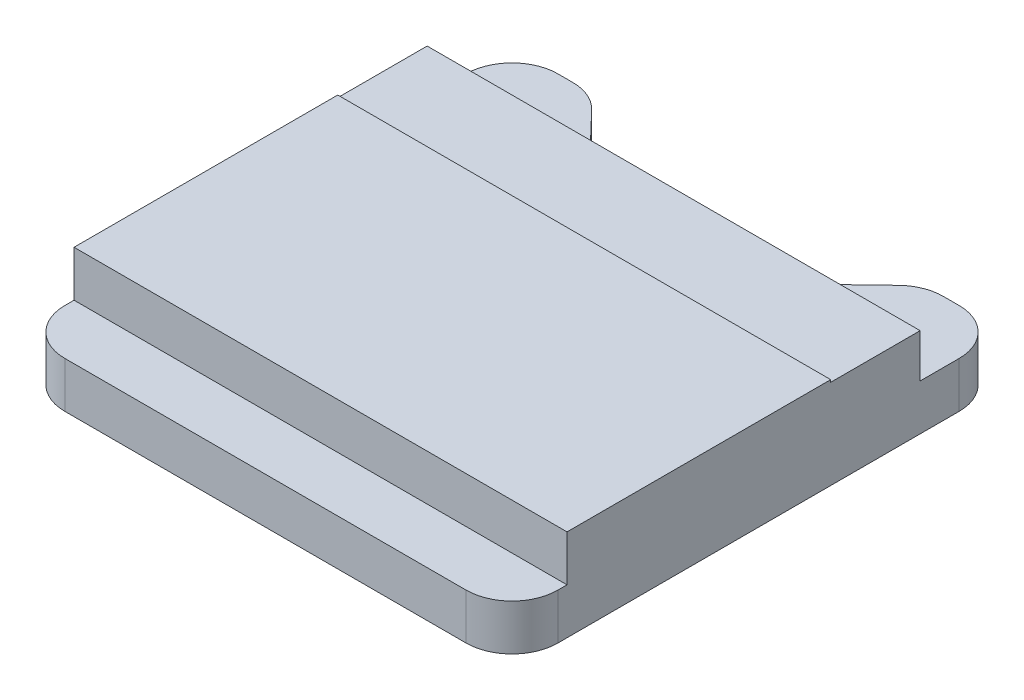
from build123d import *

# Parameters (mm, degrees)
BOSS_EXTRUDE1_DEPTH = 2.54
FILLET1_R           = 2.54
SKETCH2_W           = 27.305
SKETCH2_H           = 19.558
BOSS_EXTRUDE2_DEPTH = 2.413
SKETCH3_W           = 27.305
SKETCH3_H           = 14.605
BOSS_EXTRUDE3_DEPTH = 0.127


with BuildPart() as part:
    # Sketch1 → Boss-Extrude1 (new body)
    with BuildSketch(Plane(origin=(0, 0, 0), x_dir=(1, 0, 0), z_dir=(0, 1, 0))):
        Polygon((-6.163592518, 10.4775), (-9.2075, 13.6525), (-13.6525, 13.6525), (-13.6525, -13.6525), (13.6525, -13.6525), (13.6525, 13.6525), (9.2075, 13.6525), (5.895761697, 10.4775), align=None)
    extrude(amount=BOSS_EXTRUDE1_DEPTH)

    # Fillet1
    fillet1_edges = [part.edges().sort_by_distance(p)[0] for p in [
        (9.2075, 1.27, -13.6525),
        (13.6525, 1.27, -13.6525),
        (13.6525, 1.27, 13.6525),
        (-13.6525, 1.27, 13.6525),
        (-13.6525, 1.27, -13.6525),
        (-9.2075, 1.27, -13.6525),
        (-6.163592518, 1.27, -10.4775),
        (5.895761697, 1.27, -10.4775),
    ]]
    fillet(fillet1_edges, radius=FILLET1_R)

    # Sketch2 → Boss-Extrude2 (add)
    with BuildSketch(Plane(origin=(0, 2.54, 0), x_dir=(1, 0, 0), z_dir=(0, 1, 0))):
        with Locations((0, -0.8255)):
            Rectangle(SKETCH2_W, SKETCH2_H)
    extrude(amount=BOSS_EXTRUDE2_DEPTH)

    # Sketch3 → Boss-Extrude3 (add)
    with BuildSketch(Plane(origin=(0, 4.953, 0), x_dir=(1, 0, 0), z_dir=(0, 1, 0))):
        with Locations((0, -3.302)):
            Rectangle(SKETCH3_W, SKETCH3_H)
    extrude(amount=BOSS_EXTRUDE3_DEPTH)


solid = part.part
